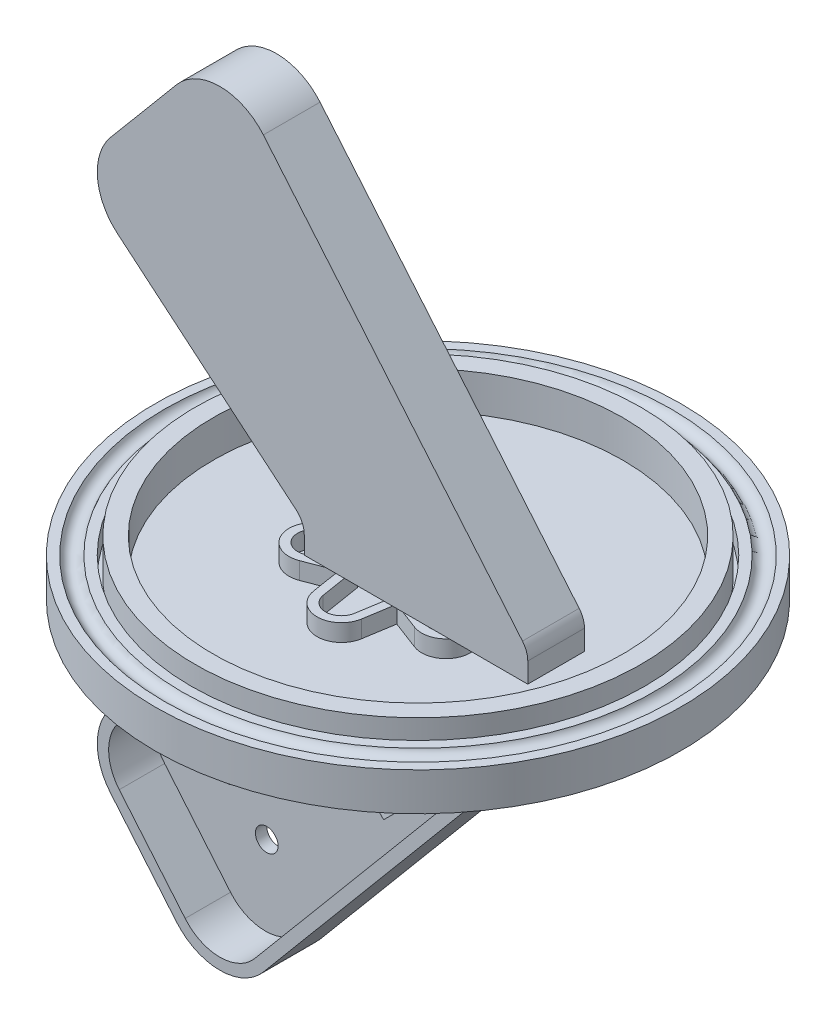
from build123d import *

# Parameters (mm, degrees)
SKETCH1_R           = 82.55
BOSS_EXTRUDE1_DEPTH = 3.175
SKETCH3_R           = 1.65
CUT_EXTRUDE2_DEPTH  = 3.175
CIRPATTERN1_COUNT   = 4
SKETCH4_R           = 46.35
SKETCH4_R_2         = 40
BOSS_EXTRUDE2_DEPTH = 3.525
SKETCH7_R           = 1.5875
CUT_EXTRUDE3_START  = -10
SKETCH8_R           = 111.48971666
SKETCH8_R_2         = 46.35
CUT_EXTRUDE3_DEPTH  = 10
BOSS_EXTRUDE4_DEPTH = 10
CUT_EXTRUDE4_DEPTH  = 8
SKETCH14_R          = 2
CUT_EXTRUDE5_DEPTH  = 2
BOSS_EXTRUDE5_DEPTH = 3.025
SKETCH16_R          = 39.3
SKETCH16_R_2        = 36.125
BOSS_EXTRUDE6_DEPTH = 6.5


with BuildPart() as part:
    # Sketch1 → Boss-Extrude1 (new body)
    with BuildSketch(Plane(origin=(0, 0, 0), x_dir=(1, 0, 0), z_dir=(0, 1, 0))):
        with Locations(Location((0, 0, 0), (0, 0, 270))):
            Circle(SKETCH1_R)
    extrude(amount=BOSS_EXTRUDE1_DEPTH)

    # Sketch3 → Cut-Extrude2 (cut)
    with BuildSketch(Plane(origin=(0, 3.175, 0), x_dir=(1, 0, 0), z_dir=(0, 1, 0))):
        with Locations(Location((-76.2, 0, 0), (0, 0, 270))):
            Circle(SKETCH3_R)
    cut_extrude2 = extrude(amount=-CUT_EXTRUDE2_DEPTH, mode=Mode.SUBTRACT)

    # CirPattern1: Cut-Extrude2 ×4 about axis
    cirpattern1_axis = Axis((0, 0, 0), (0, 1, 0))
    for i in range(1, CIRPATTERN1_COUNT):
        add(cut_extrude2.rotate(cirpattern1_axis, i * 360 / CIRPATTERN1_COUNT), mode=Mode.SUBTRACT)

    # Sketch4 → Boss-Extrude2 (add)
    with BuildSketch(Plane(origin=(0, 3.175, 0), x_dir=(1, 0, 0), z_dir=(0, 1, 0))):
        with Locations(Location((-9.65, 0, 0), (0, 0, 270))):
            Circle(SKETCH4_R)
        with Locations(Location((-9.65, 0, 0), (0, 0, 270))):
            Circle(SKETCH4_R_2, mode=Mode.SUBTRACT)
    extrude(amount=BOSS_EXTRUDE2_DEPTH)

    # Sketch7 → Cut-Revolve1 (revolve, cut)
    with BuildSketch(Plane.XY, mode=Mode.PRIVATE) as cut_revolve1_sk:
        with Locations((-52.825, 7.2)):
            Circle(SKETCH7_R)
    revolve(cut_revolve1_sk.sketch.rotate(Axis((-9.65, 3.175, 0), (0, 1, 0)), 270), axis=Axis((-9.65, 3.175, 0), (0, 1, 0)), mode=Mode.SUBTRACT)

    # Sketch8 → Cut-Extrude3 (cut)
    with BuildSketch(Plane(origin=(0, 3.175, 0), x_dir=(1, 0, 0), z_dir=(0, 1, 0)).offset(CUT_EXTRUDE3_START)):
        with Locations((-9.65, 0)):
            Circle(SKETCH8_R)
        with Locations(Location((-9.65, 0, 0), (0, 0, 270))):
            Circle(SKETCH8_R_2, mode=Mode.SUBTRACT)
    extrude(amount=CUT_EXTRUDE3_DEPTH, mode=Mode.SUBTRACT)


with BuildPart() as body_2:
    # Sketch12 → Boss-Extrude4 (new body)
    with BuildSketch(Plane.XY):
        with BuildLine():
            Line((-19.706383669, 6.7), (-19.706383669, 9.834769367))
            ThreePointArc((-19.706383669, 9.834769367), (-20.08115252, 11.525242414), (-21.13523323, 12.89894714))
            Line((-21.13523323, 12.89894714), (-52.6331719, 39.328855861))
            ThreePointArc((-52.6331719, 39.328855861), (-56.167242784, 46.117742865), (-53.865740235, 53.417176389))
            Line((-53.865740235, 53.417176389), (-42.242556375, 67.269147511))
            ThreePointArc((-42.242556375, 67.269147511), (-34.582111944, 70.841271414), (-26.921667513, 67.269147511))
            Line((-26.921667513, 67.269147511), (18.770561441, 12.815269502))
            ThreePointArc((18.770561441, 12.815269502), (19.465154152, 11.612199636), (19.706383669, 10.244119063))
            Line((19.706383669, 10.244119063), (19.706383669, 6.7))
            Line((19.706383669, 6.7), (-19.706383669, 6.7))
        make_face()
    boss_extrude4 = extrude(amount=BOSS_EXTRUDE4_DEPTH)


with BuildPart() as part_1:
    add(part.part)

    # Mirror3: Boss-Extrude4 across plane
    add(boss_extrude4.mirror(Plane.ZX.offset(3.35)))

    # Sketch13 → Cut-Extrude4 (cut)
    with BuildSketch(Plane.XY.offset(10)):
        with BuildLine():
            Line((-28.453756399, -59.283572292), (17.238472555, -4.829694282))
            ThreePointArc((17.238472555, -4.829694282), (17.58576891, -4.22815935), (17.706383669, -3.544119063))
            Line((17.706383669, -3.544119063), (17.706383669, -2))
            Line((17.706383669, -2), (-17.706383669, -2))
            Line((-17.706383669, -2), (-17.706383669, -3.134769367))
            ThreePointArc((-17.706383669, -3.134769367), (-18.268536946, -5.670478938), (-19.84965801, -7.731036026))
            Line((-19.84965801, -7.731036026), (-51.347596681, -34.160944747))
            ThreePointArc((-51.347596681, -34.160944747), (-54.174853388, -39.59205435), (-52.333651348, -45.43160117))
            Line((-52.333651348, -45.43160117), (-40.710467489, -59.283572292))
            ThreePointArc((-40.710467489, -59.283572292), (-34.582111944, -62.141271414), (-28.453756399, -59.283572292))
        make_face()
    extrude(amount=-CUT_EXTRUDE4_DEPTH, mode=Mode.SUBTRACT)

    # Sketch14 → Cut-Extrude5 (cut)
    with BuildSketch(Plane.XY.offset(2)):
        with Locations((-7.236356621, -6.813172798)):
            Circle(SKETCH14_R)
        with Locations((-0.165288809, -13.88424061)):
            Circle(SKETCH14_R)
        with Locations((-41.389614152, -40.96643033)):
            Circle(SKETCH14_R)
        with Locations((-34.31854634, -48.037498142)):
            Circle(SKETCH14_R)
        Polygon((-13.706383669, -6), (0.64788399, -20.354267658), (-13.706383669, -34.708535316), (-28.060651327, -20.354267658), align=None)
    extrude(amount=-CUT_EXTRUDE5_DEPTH, mode=Mode.SUBTRACT)

    # Sketch15 → Boss-Extrude5 (add)
    with BuildSketch(Plane(origin=(0, 3.175, 0), x_dir=(1, 0, 0), z_dir=(0, 1, 0))):
        with BuildLine():
            Line((-19.859505654, 0), (-24.055564638, -3.414883715))
            ThreePointArc((-24.055564638, -3.414883715), (-25.065252187, -8.9), (-19.810158367, -10.768143075))
            Line((-19.810158367, -10.768143075), (-14.754752827, -8.841691257))
            Line((-14.754752827, -8.841691257), (-13.895406271, -14.183026789))
            ThreePointArc((-13.895406271, -14.183026789), (-9.65, -17.8), (-5.404593729, -14.183026789))
            Line((-5.404593729, -14.183026789), (-4.545247173, -8.841691257))
            Line((-4.545247173, -8.841691257), (0.510158367, -10.768143075))
            ThreePointArc((0.510158367, -10.768143075), (5.765252187, -8.9), (4.755564638, -3.414883715))
            Line((4.755564638, -3.414883715), (0.559505654, 0))
            Line((0.559505654, 0), (4.755564638, 3.414883715))
            ThreePointArc((4.755564638, 3.414883715), (5.765252187, 8.9), (0.510158367, 10.768143075))
            Line((0.510158367, 10.768143075), (-4.545247173, 8.841691257))
            Line((-4.545247173, 8.841691257), (-5.404593729, 14.183026789))
            ThreePointArc((-5.404593729, 14.183026789), (-9.65, 17.8), (-13.895406271, 14.183026789))
            Line((-13.895406271, 14.183026789), (-14.754752827, 8.841691257))
            Line((-14.754752827, 8.841691257), (-19.810158367, 10.768143075))
            ThreePointArc((-19.810158367, 10.768143075), (-25.065252187, 8.9), (-24.055564637, 3.414883715))
            Line((-24.055564637, 3.414883715), (-19.859505654, 0))
        make_face()
        with BuildLine():
            ThreePointArc((-23.108743119, -4.578296372), (-23.766214082, -8.15), (-20.344292524, -9.366465258))
            Line((-20.344292524, -9.366465258), (-13.566566904, -6.783692869))
            Line((-13.566566904, -6.783692869), (-12.414450595, -13.94476163))
            ThreePointArc((-12.414450595, -13.94476163), (-9.65, -16.3), (-6.885549405, -13.94476163))
            Line((-6.885549405, -13.94476163), (-5.733433096, -6.783692869))
            Line((-5.733433096, -6.783692869), (1.044292524, -9.366465258))
            ThreePointArc((1.044292524, -9.366465258), (4.466214082, -8.15), (3.808743119, -4.578296372))
            Line((3.808743119, -4.578296372), (-1.816866192, 0))
            Line((-1.816866192, 0), (3.808743119, 4.578296372))
            ThreePointArc((3.808743119, 4.578296372), (4.466214082, 8.15), (1.044292524, 9.366465258))
            Line((1.044292524, 9.366465258), (-5.733433096, 6.783692869))
            Line((-5.733433096, 6.783692869), (-6.885549405, 13.94476163))
            ThreePointArc((-6.885549405, 13.94476163), (-9.65, 16.3), (-12.414450595, 13.94476163))
            Line((-12.414450595, 13.94476163), (-13.566566904, 6.783692869))
            Line((-13.566566904, 6.783692869), (-20.344292524, 9.366465258))
            ThreePointArc((-20.344292524, 9.366465258), (-23.766214082, 8.15), (-23.108743119, 4.578296372))
            Line((-23.108743119, 4.578296372), (-17.483133808, 0))
            Line((-17.483133808, 0), (-23.108743119, -4.578296372))
        make_face(mode=Mode.SUBTRACT)
    extrude(amount=BOSS_EXTRUDE5_DEPTH)

    # Sketch16 → Boss-Extrude6 (add)
    with BuildSketch(Plane(origin=(0, 3.175, 0), x_dir=(1, 0, 0), z_dir=(0, 1, 0))):
        with Locations(Location((-9.65, 0, 0), (0, 0, 90))):
            Circle(SKETCH16_R)
        with Locations(Location((-9.65, 0, 0), (0, 0, 90))):
            Circle(SKETCH16_R_2, mode=Mode.SUBTRACT)
    extrude(amount=BOSS_EXTRUDE6_DEPTH)


solid = Compound([body_2.part, part_1.part])
